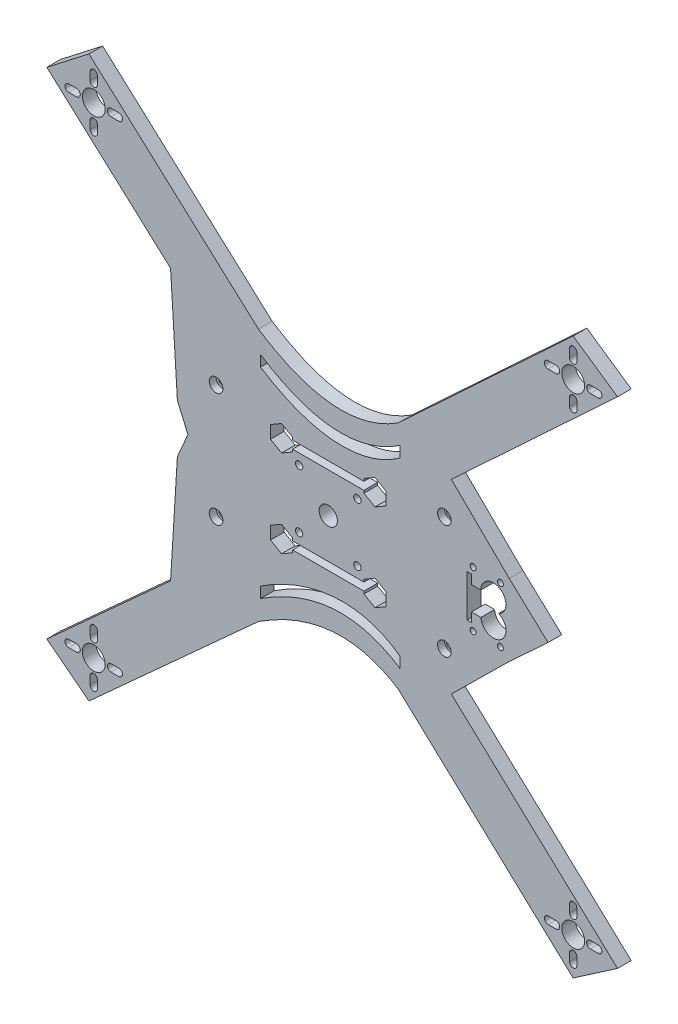
from build123d import *

# Parameters (mm, degrees)
SKETCH2_R           = 2.12884706
SKETCH2_R_2         = 1.886403579
SKETCH2_R_3         = 5
SKETCH2_R_4         = 1.3
BOSS_EXTRUDE1_DEPTH = 6
SKETCH4_R           = 4
CUT_EXTRUDE1_DEPTH  = 177.499978614
SKETCH6_R           = 1.6
CUT_EXTRUDE2_DEPTH  = 10
SKETCH7_R           = 3
CUT_EXTRUDE3_DEPTH  = 3


with BuildPart() as part:
    # Sketch2 → Boss-Extrude1 (new body)
    with BuildSketch(Plane.XY):
        with BuildLine():
            Line((107.268068856, 121.763750377), (30.643718806, 50.49255909))
            add(Edge.make_bspline(
                [(-30.577613256, 55.465717784), (3.68918056, 33.102534026), (30.643718806, 50.49255909)],
                knots=[0, 0, 0, 1, 1, 1], degree=2))
            Line((-30.577613256, 55.465717784), (-104.815323307, 122.737697407))
            Line((-104.815323307, 122.737697407), (-123.270181162, 108.422488375))
            Line((-123.270181162, 108.422488375), (-69.068013806, 59.306114832))
            Line((-69.068013806, 59.306114832), (-66.079109037, 10.62306592))
            Line((-66.079109037, 10.62306592), (-61.457141577, 0))
            Line((-61.457141577, 0), (-66.079109037, -10.62306592))
            Line((-66.079109037, -10.62306592), (-69.068013806, -59.306114832))
            Line((-69.068013806, -59.306114832), (-123.270181162, -108.422488375))
            Line((-123.270181162, -108.422488375), (-104.815323307, -122.737697407))
            Line((-104.815323307, -122.737697407), (-30.577613256, -55.465717784))
            add(Edge.make_bspline(
                [(-30.577613256, -55.465717784), (3.68918056, -33.102534026), (30.643718806, -50.49255909)],
                knots=[0, 0, 0, 1, 1, 1], degree=2))
            Line((30.643718806, -50.49255909), (107.268068856, -121.763750377))
            Line((107.268068856, -121.763750377), (126.695303918, -108.422488375))
            Line((126.695303918, -108.422488375), (53.914045925, -40.725901623))
            Line((53.914045925, -40.725901623), (79.275072573, -15.697977374))
            Line((79.275072573, -15.697977374), (96.29587424, 0))
            Line((96.29587424, 0), (79.275072573, 15.802022626))
            Line((79.275072573, 15.802022626), (53.914045925, 40.725901623))
            Line((53.914045925, 40.725901623), (126.695303918, 108.422488375))
            Line((126.695303918, 108.422488375), (107.268068856, 121.763750377))
        make_face()
        with Locations((50.871059981, 25)):
            Circle(SKETCH2_R, mode=Mode.SUBTRACT)
        with Locations((-49.127984662, 25)):
            Circle(SKETCH2_R_2, mode=Mode.SUBTRACT)
        with Locations((-102.70412576, 105.33588321)):
            Circle(SKETCH2_R_3, mode=Mode.SUBTRACT)
        with Locations((107.29587424, 105.33588321)):
            Circle(SKETCH2_R_3, mode=Mode.SUBTRACT)
        with Locations(Location((107.29587424, -105.33588321, 0), (0, 0, 180))):
            Circle(SKETCH2_R_3, mode=Mode.SUBTRACT)
        with Locations(Location((-102.70412576, -105.33588321, 0), (0, 0, 180))):
            Circle(SKETCH2_R_3, mode=Mode.SUBTRACT)
        with Locations(Location((-49.127984662, -25, 0), (0, 0, 180))):
            Circle(SKETCH2_R_2, mode=Mode.SUBTRACT)
        with Locations(Location((50.871059981, -25, 0), (0, 0, 180))):
            Circle(SKETCH2_R, mode=Mode.SUBTRACT)
        with Locations((63.434372896, 12.210852574)):
            Circle(SKETCH2_R_4, mode=Mode.SUBTRACT)
        with Locations((75.434372896, 12.202022626)):
            Circle(SKETCH2_R_4, mode=Mode.SUBTRACT)
        with Locations((63.434372896, -12.097977374)):
            Circle(SKETCH2_R_4, mode=Mode.SUBTRACT)
        with Locations((75.434372896, -12.097977374)):
            Circle(SKETCH2_R_4, mode=Mode.SUBTRACT)
        with BuildLine():
            Line((31.46957898, 42.344622875), (31.46957898, 37.594233612))
            add(Edge.make_bspline(
                [(-29.675705803, 41.551330176), (-7.053468742, 26.788151446), (14.974493182, 25.631660223), (31.46957898, 37.594233612)],
                knots=[0, 0, 0, 0, 1, 1, 1, 1], degree=3))
            Line((-29.675705803, 41.551330176), (-29.675705803, 46.301719439))
            add(Edge.make_bspline(
                [(-29.675705803, 46.301719439), (4.257649788, 24.156951343), (31.46957898, 42.344622875)],
                knots=[0, 0, 0, 1, 1, 1], degree=2))
        make_face(mode=Mode.SUBTRACT)
        with BuildLine():
            Line((-91.70412576, 103.73588321), (-95.20412576, 103.73588321))
            ThreePointArc((-95.20412576, 103.73588321), (-96.80412576, 105.33588321), (-95.20412576, 106.93588321))
            Line((-95.20412576, 106.93588321), (-91.70412576, 106.93588321))
            ThreePointArc((-91.70412576, 106.93588321), (-90.10412576, 105.33588321), (-91.70412576, 103.73588321))
        make_face(mode=Mode.SUBTRACT)
        with BuildLine():
            Line((-104.30412576, 94.33588321), (-104.30412576, 97.83588321))
            ThreePointArc((-104.30412576, 97.83588321), (-102.70412576, 99.43588321), (-101.10412576, 97.83588321))
            Line((-101.10412576, 97.83588321), (-101.10412576, 94.33588321))
            ThreePointArc((-101.10412576, 94.33588321), (-102.70412576, 92.73588321), (-104.30412576, 94.33588321))
        make_face(mode=Mode.SUBTRACT)
        with BuildLine():
            Line((-113.70412576, 106.93588321), (-110.20412576, 106.93588321))
            ThreePointArc((-110.20412576, 106.93588321), (-108.60412576, 105.33588321), (-110.20412576, 103.73588321))
            Line((-110.20412576, 103.73588321), (-113.70412576, 103.73588321))
            ThreePointArc((-113.70412576, 103.73588321), (-115.30412576, 105.33588321), (-113.70412576, 106.93588321))
        make_face(mode=Mode.SUBTRACT)
        with BuildLine():
            Line((-101.10412576, 116.33588321), (-101.10412576, 112.83588321))
            ThreePointArc((-101.10412576, 112.83588321), (-102.70412576, 111.23588321), (-104.30412576, 112.83588321))
            Line((-104.30412576, 112.83588321), (-104.30412576, 116.33588321))
            ThreePointArc((-104.30412576, 116.33588321), (-102.70412576, 117.93588321), (-101.10412576, 116.33588321))
        make_face(mode=Mode.SUBTRACT)
        with BuildLine():
            Line((118.29587424, 103.73588321), (114.79587424, 103.73588321))
            ThreePointArc((114.79587424, 103.73588321), (113.19587424, 105.33588321), (114.79587424, 106.93588321))
            Line((114.79587424, 106.93588321), (118.29587424, 106.93588321))
            ThreePointArc((118.29587424, 106.93588321), (119.89587424, 105.33588321), (118.29587424, 103.73588321))
        make_face(mode=Mode.SUBTRACT)
        with BuildLine():
            Line((105.69587424, 94.33588321), (105.69587424, 97.83588321))
            ThreePointArc((105.69587424, 97.83588321), (107.29587424, 99.43588321), (108.89587424, 97.83588321))
            Line((108.89587424, 97.83588321), (108.89587424, 94.33588321))
            ThreePointArc((108.89587424, 94.33588321), (107.29587424, 92.73588321), (105.69587424, 94.33588321))
        make_face(mode=Mode.SUBTRACT)
        with BuildLine():
            Line((96.29587424, 106.93588321), (99.79587424, 106.93588321))
            ThreePointArc((99.79587424, 106.93588321), (101.39587424, 105.33588321), (99.79587424, 103.73588321))
            Line((99.79587424, 103.73588321), (96.29587424, 103.73588321))
            ThreePointArc((96.29587424, 103.73588321), (94.69587424, 105.33588321), (96.29587424, 106.93588321))
        make_face(mode=Mode.SUBTRACT)
        with BuildLine():
            Line((108.89587424, 116.33588321), (108.89587424, 112.83588321))
            ThreePointArc((108.89587424, 112.83588321), (107.29587424, 111.23588321), (105.69587424, 112.83588321))
            Line((105.69587424, 112.83588321), (105.69587424, 116.33588321))
            ThreePointArc((105.69587424, 116.33588321), (107.29587424, 117.93588321), (108.89587424, 116.33588321))
        make_face(mode=Mode.SUBTRACT)
        with BuildLine():
            Line((118.29587424, -103.73588321), (114.79587424, -103.73588321))
            ThreePointArc((114.79587424, -103.73588321), (113.19587424, -105.33588321), (114.79587424, -106.93588321))
            Line((114.79587424, -106.93588321), (118.29587424, -106.93588321))
            ThreePointArc((118.29587424, -106.93588321), (119.89587424, -105.33588321), (118.29587424, -103.73588321))
        make_face(mode=Mode.SUBTRACT)
        with BuildLine():
            Line((-91.70412576, -103.73588321), (-95.20412576, -103.73588321))
            ThreePointArc((-95.20412576, -103.73588321), (-96.80412576, -105.33588321), (-95.20412576, -106.93588321))
            Line((-95.20412576, -106.93588321), (-91.70412576, -106.93588321))
            ThreePointArc((-91.70412576, -106.93588321), (-90.10412576, -105.33588321), (-91.70412576, -103.73588321))
        make_face(mode=Mode.SUBTRACT)
        with BuildLine():
            Line((-104.30412576, -94.33588321), (-104.30412576, -97.83588321))
            ThreePointArc((-104.30412576, -97.83588321), (-102.70412576, -99.43588321), (-101.10412576, -97.83588321))
            Line((-101.10412576, -97.83588321), (-101.10412576, -94.33588321))
            ThreePointArc((-101.10412576, -94.33588321), (-102.70412576, -92.73588321), (-104.30412576, -94.33588321))
        make_face(mode=Mode.SUBTRACT)
        with BuildLine():
            Line((-113.70412576, -106.93588321), (-110.20412576, -106.93588321))
            ThreePointArc((-110.20412576, -106.93588321), (-108.60412576, -105.33588321), (-110.20412576, -103.73588321))
            Line((-110.20412576, -103.73588321), (-113.70412576, -103.73588321))
            ThreePointArc((-113.70412576, -103.73588321), (-115.30412576, -105.33588321), (-113.70412576, -106.93588321))
        make_face(mode=Mode.SUBTRACT)
        with BuildLine():
            Line((-101.10412576, -116.33588321), (-101.10412576, -112.83588321))
            ThreePointArc((-101.10412576, -112.83588321), (-102.70412576, -111.23588321), (-104.30412576, -112.83588321))
            Line((-104.30412576, -112.83588321), (-104.30412576, -116.33588321))
            ThreePointArc((-104.30412576, -116.33588321), (-102.70412576, -117.93588321), (-101.10412576, -116.33588321))
        make_face(mode=Mode.SUBTRACT)
        with BuildLine():
            Line((105.69587424, -94.33588321), (105.69587424, -97.83588321))
            ThreePointArc((105.69587424, -97.83588321), (107.29587424, -99.43588321), (108.89587424, -97.83588321))
            Line((108.89587424, -97.83588321), (108.89587424, -94.33588321))
            ThreePointArc((108.89587424, -94.33588321), (107.29587424, -92.73588321), (105.69587424, -94.33588321))
        make_face(mode=Mode.SUBTRACT)
        with BuildLine():
            Line((96.29587424, -106.93588321), (99.79587424, -106.93588321))
            ThreePointArc((99.79587424, -106.93588321), (101.39587424, -105.33588321), (99.79587424, -103.73588321))
            Line((99.79587424, -103.73588321), (96.29587424, -103.73588321))
            ThreePointArc((96.29587424, -103.73588321), (94.69587424, -105.33588321), (96.29587424, -106.93588321))
        make_face(mode=Mode.SUBTRACT)
        with BuildLine():
            Line((108.89587424, -116.33588321), (108.89587424, -112.83588321))
            ThreePointArc((108.89587424, -112.83588321), (107.29587424, -111.23588321), (105.69587424, -112.83588321))
            Line((105.69587424, -112.83588321), (105.69587424, -116.33588321))
            ThreePointArc((105.69587424, -116.33588321), (107.29587424, -117.93588321), (108.89587424, -116.33588321))
        make_face(mode=Mode.SUBTRACT)
        with BuildLine():
            Line((-29.675705803, -46.301719439), (-29.675705803, -41.551330176))
            add(Edge.make_bspline(
                [(-29.675705803, -41.551330176), (-7.053468742, -26.788151446), (14.974493182, -25.631660223), (31.46957898, -37.594233612)],
                knots=[0, 0, 0, 0, 1, 1, 1, 1], degree=3))
            Line((31.46957898, -37.594233612), (31.46957898, -42.344622875))
            add(Edge.make_bspline(
                [(-29.675705803, -46.301719439), (4.257649788, -24.156951343), (31.46957898, -42.344622875)],
                knots=[0, 0, 0, 1, 1, 1], degree=2))
        make_face(mode=Mode.SUBTRACT)
        with BuildLine():
            Line((62.71883554, 9.183127296), (60.818955668, 9.183127296))
            Line((60.818955668, 9.183127296), (60.818955668, 5.187149894))
            Line((60.818955668, 5.187149894), (60.818955668, -5.187149894))
            Line((60.818955668, -5.187149894), (60.818955668, -9.183127296))
            Line((60.818955668, -9.183127296), (62.71883554, -9.183127296))
            Line((62.71883554, -9.183127296), (62.71883554, -5.187149894))
            Line((62.71883554, -5.187149894), (66.859601466, -5.187149894))
            ThreePointArc((66.859601466, -5.187149894), (75.470785979, -9.322303968), (74.65486094, 0.195377696))
            ThreePointArc((74.65486094, 0.195377696), (75.307934559, 9.821282423), (66.845703017, 5.187149894))
            Line((66.845703017, 5.187149894), (62.71883554, 5.187149894))
            Line((62.71883554, 5.187149894), (62.71883554, 9.183127296))
        make_face(mode=Mode.SUBTRACT)
    extrude(amount=BOSS_EXTRUDE1_DEPTH)

    # Sketch4 → Cut-Extrude1 (cut, through all)
    with BuildSketch(Plane.XY.offset(6)):
        Circle(SKETCH4_R)
        Polygon((-15.617431812, 20.822942063), (15.617431812, 20.822942063), (15.617431812, 21.909869421), (20.464406339, 24.708271469), (25.311380865, 21.909869421), (25.311380865, 16.313065325), (20.464406339, 13.514663277), (15.617431812, 16.313065325), (15.617431812, 17.399992683), (-15.617431812, 17.399992683), (-15.617431812, 16.313065325), (-20.464406339, 13.514663277), (-25.311380865, 16.313065325), (-25.311380865, 21.909869421), (-20.464406339, 24.708271469), (-15.617431812, 21.909869421), align=None)
        Polygon((-15.617431812, -20.822942063), (-15.617431812, -21.909869421), (-20.464406339, -24.708271469), (-25.311380865, -21.909869421), (-25.311380865, -16.313065325), (-20.464406339, -13.514663277), (-15.617431812, -16.313065325), (-15.617431812, -17.399992683), (15.617431812, -17.399992683), (15.617431812, -16.313065325), (20.464406339, -13.514663277), (25.311380865, -16.313065325), (25.311380865, -21.909869421), (20.464406339, -24.708271469), (15.617431812, -21.909869421), (15.617431812, -20.822942063), align=None)
    extrude(amount=-CUT_EXTRUDE1_DEPTH, mode=Mode.SUBTRACT)

    # Sketch6 → Cut-Extrude2 (cut)
    with BuildSketch(Plane(origin=(0, 0, 0), x_dir=(-1, 0, 0), z_dir=(0, 0, -1))):
        with Locations((-12.75, 12.75)):
            Circle(SKETCH6_R)
        with Locations((12.75, 12.75)):
            Circle(SKETCH6_R)
        with Locations((12.75, -12.75)):
            Circle(SKETCH6_R)
        with Locations((-12.75, -12.75)):
            Circle(SKETCH6_R)
    extrude(amount=-CUT_EXTRUDE2_DEPTH, mode=Mode.SUBTRACT)

    # Sketch7 → Cut-Extrude3 (cut)
    with BuildSketch(Plane.XY.offset(6)):
        with Locations((-49.127984662, 25)):
            Circle(SKETCH7_R)
        with Locations((-49.127984662, -25)):
            Circle(SKETCH7_R)
        with Locations((50.871059981, -25)):
            Circle(SKETCH7_R)
        with Locations((50.871059981, 25)):
            Circle(SKETCH7_R)
    extrude(amount=-CUT_EXTRUDE3_DEPTH, mode=Mode.SUBTRACT)


solid = part.part
